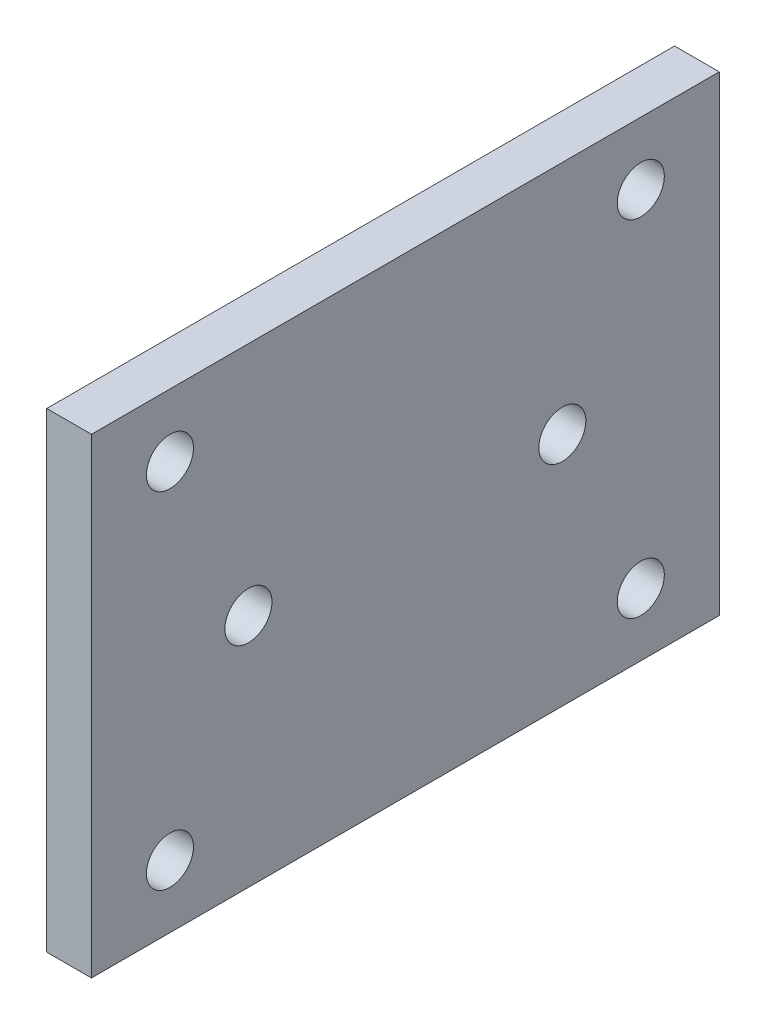
from build123d import *

# Parameters (mm, degrees)
SKETCH1_W           = 40
SKETCH1_H           = 30
BOSS_EXTRUDE1_DEPTH = 2.85
SKETCH2_R           = 1.5
CUT_EXTRUDE1_DEPTH  = 26.161925602
SKETCH3_R           = 1.5
CUT_EXTRUDE2_DEPTH  = 26.161925602


with BuildPart() as part:
    # Sketch1 → Boss-Extrude1 (new body)
    with BuildSketch(Plane(origin=(0, 0, 0), x_dir=(0, 0, -1), z_dir=(1, 0, 0))):
        Rectangle(SKETCH1_W, SKETCH1_H)
    extrude(amount=BOSS_EXTRUDE1_DEPTH)

    # Sketch2 → Cut-Extrude1 (cut, through all)
    with BuildSketch(Plane(origin=(2.85, 0, 0), x_dir=(0, 0, -1), z_dir=(1, 0, 0))):
        with Locations((-10, 0)):
            Circle(SKETCH2_R)
        with Locations((10, 0)):
            Circle(SKETCH2_R)
    extrude(amount=-CUT_EXTRUDE1_DEPTH, mode=Mode.SUBTRACT)

    # Sketch3 → Cut-Extrude2 (cut, through all)
    with BuildSketch(Plane(origin=(2.85, 0, 0), x_dir=(0, 0, -1), z_dir=(1, 0, 0))):
        with Locations((-15, 11)):
            Circle(SKETCH3_R)
        with Locations((15, 11)):
            Circle(SKETCH3_R)
    cut_extrude2 = extrude(amount=-CUT_EXTRUDE2_DEPTH, mode=Mode.SUBTRACT)

    # Mirror1: Cut-Extrude2 across plane
    add(cut_extrude2.mirror(Plane.ZX), mode=Mode.SUBTRACT)


solid = part.part
